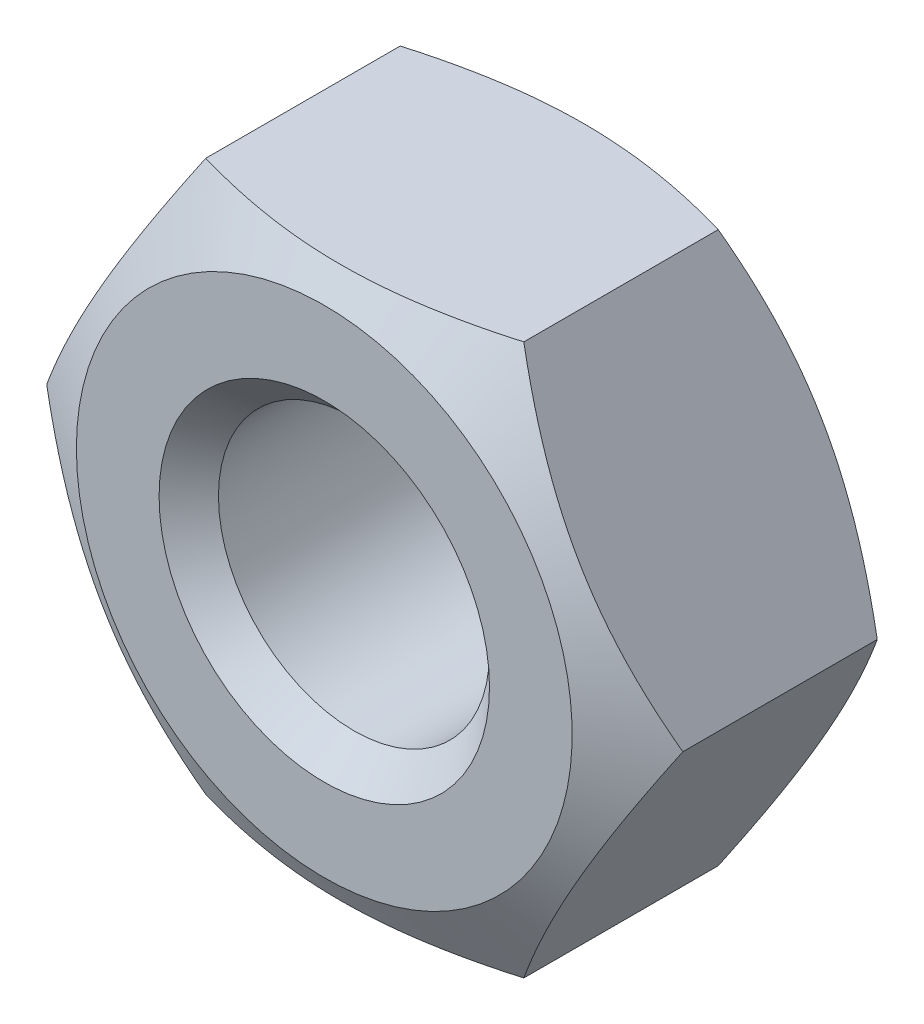
from build123d import *

# Parameters (mm, degrees)
EXTRUDE_350_DEPTH = 5


with BuildPart() as part:
    # Эскиз2 → Extrude 350 (new body)
    with BuildSketch(Plane.XY):
        Polygon((5.773502692, 0), (2.886751346, 5), (-2.886751346, 5), (-5.773502692, 0), (-2.886751346, -5), (2.886751346, -5), align=None)
    extrude(amount=EXTRUDE_350_DEPTH)

    # Эскиз3 → Вырез-Повернуть1 (revolve, cut)
    with BuildSketch(Plane(origin=(0, 0, 0), x_dir=(1, 0, 0), z_dir=(0, 1, 0))):
        Polygon((-5.773502692, 0), (-4.5, 0), (-5.773502692, -0.735257122), align=None)
        Polygon((-5.773502692, -5), (-5.773502692, -4.264742878), (-4.5, -5), align=None)
    revolve(axis=Axis((0, 0, -10), (0, 0, 1)), mode=Mode.SUBTRACT)

    # Эскиз4 → Hole Wizard 701 (revolve, cut)
    with BuildSketch(Plane.YZ):
        Polygon((0, 0), (0, 5), (3, 5), (2.46, 4.46), (2.46, 0.54), (3, 0), align=None)
    revolve(axis=Axis((0, 0, -6.35), (0, 0, 1)), mode=Mode.SUBTRACT)


solid = part.part
